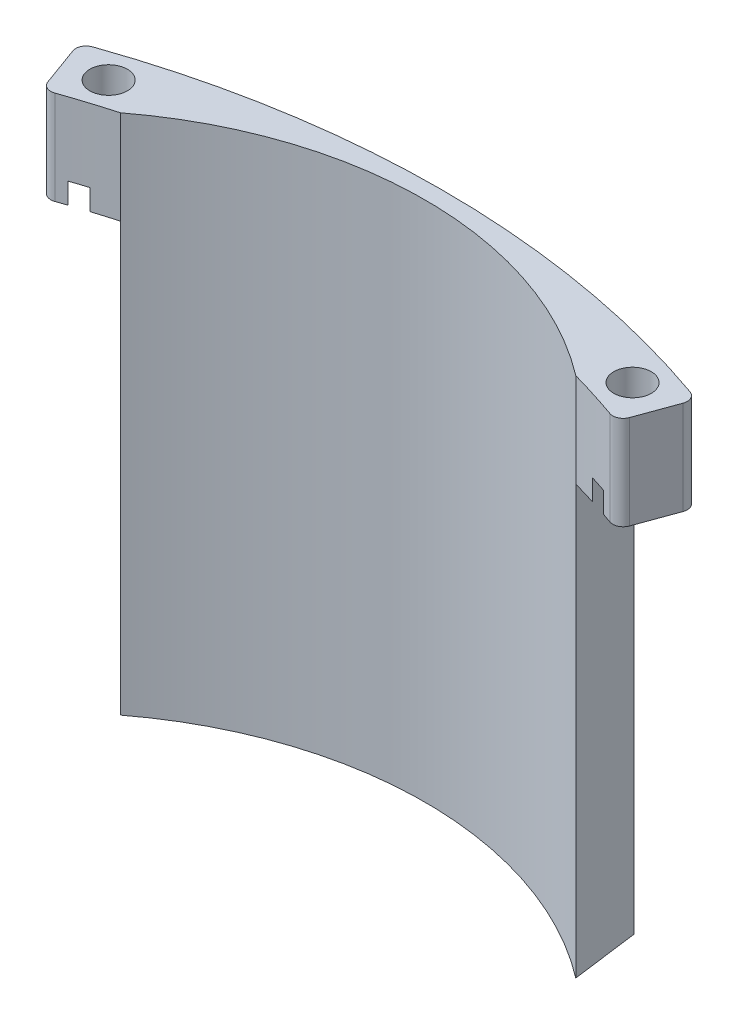
from build123d import *

# Parameters (mm, degrees)
BOSS_EXTRUDE1_DEPTH  = 50
M3_CLEARANCE_HOLE1_D = 3.6
CUT_EXTRUDE1_START   = -41
CUT_EXTRUDE1_DEPTH   = 41
CUT_EXTRUDE2_DEPTH   = 2
FILLET1_R            = 1


with BuildPart() as part:
    # Sketch1 → Boss-Extrude1 (new body)
    with BuildSketch(Plane(origin=(0, 0, 0), x_dir=(1, 0, 0), z_dir=(0, 1, 0))):
        with BuildLine():
            Line((29.584742398, 81.283411698), (27.532621538, 75.645255973))
            ThreePointArc((27.532621538, 75.645255973), (24.694417894, 76.618768751), (21.821905854, 77.485833704))
            ThreePointArc((21.821905854, 77.485833704), (0, 84.853606671), (-21.821905854, 77.485833704))
            ThreePointArc((-21.821905854, 77.485833704), (-24.694417894, 76.618768751), (-27.532621538, 75.645255973))
            Line((-27.532621538, 75.645255973), (-29.584742398, 81.283411698))
            ThreePointArc((-29.584742398, 81.283411698), (0, 86.5), (29.584742398, 81.283411698))
        make_face()
    extrude(amount=-BOSS_EXTRUDE1_DEPTH)

    # M3 Clearance Hole1 (through all)
    with Locations(Plane(origin=(0, 0, 0), x_dir=(1, 0, 0), z_dir=(0, 1, 0))):
        with Locations((-25.108934259, 79.635365387), (25.108934259, 79.635365387)):
            Hole(M3_CLEARANCE_HOLE1_D / 2)

    # Sketch4 → Cut-Extrude1 (cut)
    with BuildSketch(Plane.XZ.offset(50).offset(CUT_EXTRUDE1_START)):
        with BuildLine():
            Line((-27.532621538, -75.645255973), (-29.584742398, -81.283411698))
            ThreePointArc((-29.584742398, -81.283411698), (-25.316064331, -82.712434898), (-20.978824316, -83.917453073))
            Line((-20.978824316, -83.917453073), (-21.821905854, -77.485833704))
            ThreePointArc((-21.821905854, -77.485833704), (-24.694417894, -76.618768751), (-27.532621538, -75.645255973))
        make_face()
        with BuildLine():
            Line((27.532621538, -75.645255973), (29.584742398, -81.283411698))
            ThreePointArc((29.584742398, -81.283411698), (25.316064331, -82.712434898), (20.978824316, -83.917453073))
            Line((20.978824316, -83.917453073), (21.821905854, -77.485833704))
            ThreePointArc((21.821905854, -77.485833704), (24.694417894, -76.618768751), (27.532621538, -75.645255973))
        make_face()
    extrude(amount=CUT_EXTRUDE1_DEPTH, mode=Mode.SUBTRACT)

    # Sketch5 → Cut-Extrude2 (cut)
    with BuildSketch(Plane(origin=(0, -9, 0), x_dir=(-1, 0, 0), z_dir=(0, -1, 0))):
        Polygon((25.559170371, 76.200647431), (28.30860532, 78.30792232), (27.858369208, 81.742640277), (24.658698146, 83.070083344), (21.909263197, 80.962808455), (22.359499309, 77.528090498), align=None)
        Polygon((-28.30860532, 78.30792232), (-25.559170371, 76.200647431), (-22.359499309, 77.528090498), (-21.909263197, 80.962808455), (-24.658698146, 83.070083344), (-27.858369208, 81.742640277), align=None)
    extrude(amount=-CUT_EXTRUDE2_DEPTH, mode=Mode.SUBTRACT)

    # Fillet1
    fillet1_edges = [part.edges().sort_by_distance(p)[0] for p in [
        (27.532621538, -4.5, -75.645255973),
        (29.584742398, -4.5, -81.283411698),
        (-29.584742398, -4.5, -81.283411698),
        (-27.532621538, -4.5, -75.645255973),
    ]]
    fillet(fillet1_edges, radius=FILLET1_R)


solid = part.part
